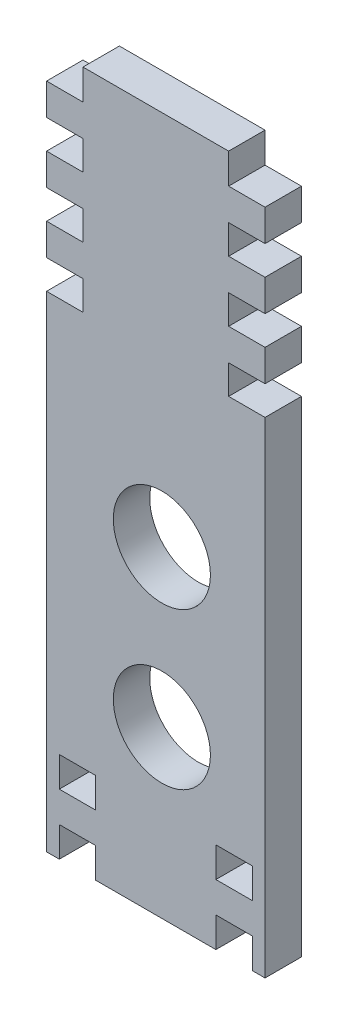
from build123d import *

# Parameters (mm, degrees)
ESQUISSE1_R        = 8
ESQUISSE1_W        = 6
ESQUISSE1_H        = 4.95
BOSS_EXTRU_1_DEPTH = 6


with BuildPart() as part:
    # Esquisse1 → Boss.-Extru.1 (new body)
    with BuildSketch(Plane.XY):
        Polygon((-12, 0), (12, 0), (12, -0.2), (12, -5), (18, -5), (18, -10.2), (12, -10.2), (12, -15), (18, -15), (18, -20.2), (12, -20.2), (12, -25), (18, -25), (18, -30.2), (12, -30.2), (12, -35), (18, -35), (18, -115), (15.9, -115), (15.9, -110.05), (9.9, -110.05), (9.9, -115), (-9.9, -115), (-9.9, -110.05), (-15.9, -110.05), (-15.9, -115), (-18, -115), (-18, -35), (-12, -35), (-12, -30.2), (-18, -30.2), (-18, -25), (-12, -25), (-12, -20.2), (-18, -20.2), (-18, -15), (-12, -15), (-12, -10.2), (-18, -10.2), (-18, -5), (-12, -5), (-12, -0.2), align=None)
        with Locations((1, -87.7)):
            Circle(ESQUISSE1_R, mode=Mode.SUBTRACT)
        with Locations((1, -62)):
            Circle(ESQUISSE1_R, mode=Mode.SUBTRACT)
        with Locations((-12.9, -102.525)):
            Rectangle(ESQUISSE1_W, ESQUISSE1_H, mode=Mode.SUBTRACT)
        with Locations((12.9, -102.525)):
            Rectangle(ESQUISSE1_W, ESQUISSE1_H, mode=Mode.SUBTRACT)
    extrude(amount=BOSS_EXTRU_1_DEPTH)


solid = part.part
